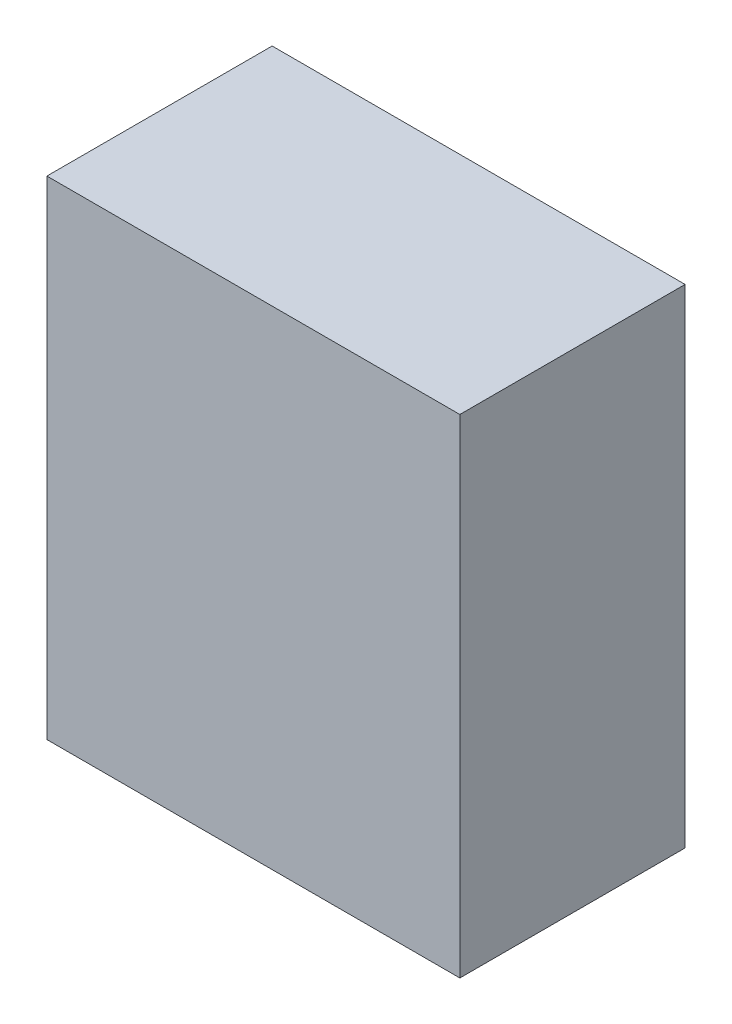
from build123d import *

# Parameters (mm, degrees)
SKETCH1_W           = 82.55
SKETCH1_H           = 69.85
BOSS_EXTRUDE1_DEPTH = 38.1
SKETCH2_R           = 12.7254
CUT_EXTRUDE1_DEPTH  = 2.8194


with BuildPart() as part:
    # Sketch1 → Boss-Extrude1 (new body)
    with BuildSketch(Plane(origin=(0, 0, 0), x_dir=(0, 1, 0), z_dir=(0, 0, 1))):
        with Locations((41.275, 34.925)):
            Rectangle(SKETCH1_W, SKETCH1_H)
    extrude(amount=BOSS_EXTRUDE1_DEPTH)

    # Sketch2 → Cut-Extrude1 (cut)
    with BuildSketch(Plane(origin=(0, 0, 0), x_dir=(0, 1, 0), z_dir=(0, 0, 1))):
        with Locations((0, 41.275)):
            Circle(SKETCH2_R)
    extrude(amount=CUT_EXTRUDE1_DEPTH, mode=Mode.SUBTRACT)


solid = part.part
